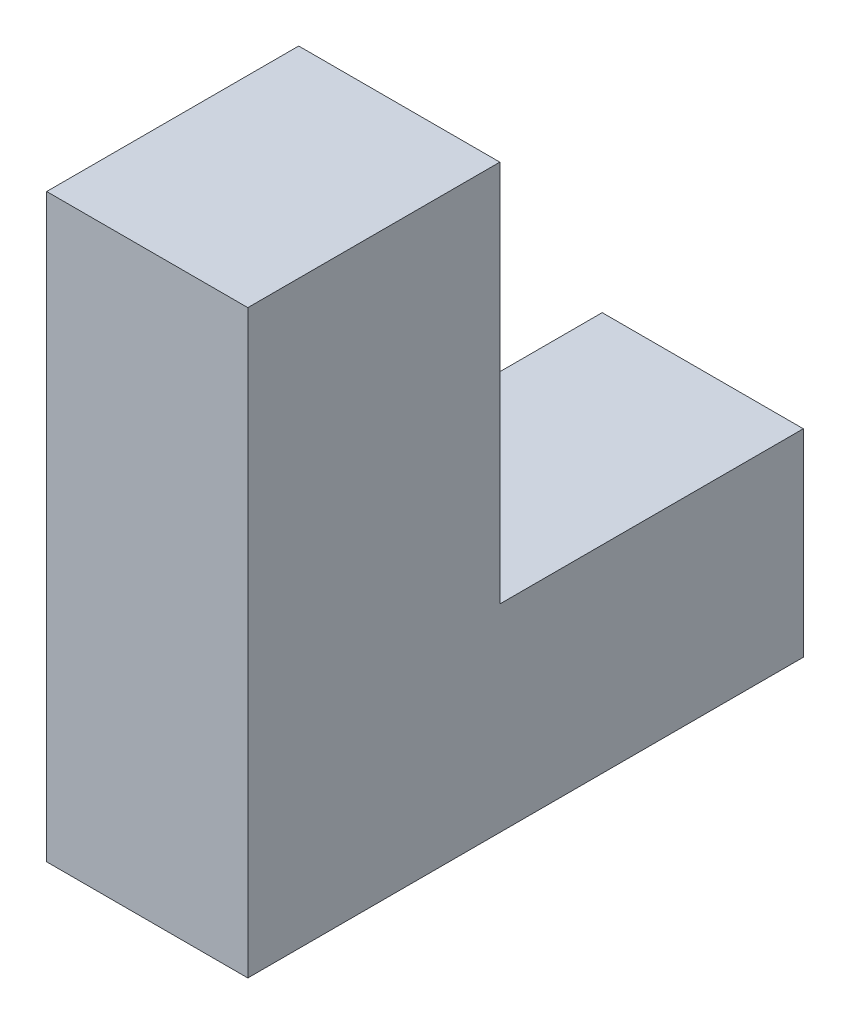
from build123d import *

# Parameters (mm, degrees)
EXTRUDE_1_DEPTH = 10


with BuildPart() as part:
    # Эскиз1 → Бобышка-Вытянуть1 (new, symmetric)
    with BuildSketch(Plane(origin=(0, 0, 0), x_dir=(0, 0, -1), z_dir=(1, 0, 0))):
        Polygon((0, -14.694985852), (0, 43.035315709), (25.060199086, 43.035315709), (25.060199086, 4.985798771), (55.237402175, 4.985798771), (55.237402175, -14.694985852), align=None)
    extrude(amount=EXTRUDE_1_DEPTH, both=True)


solid = part.part
